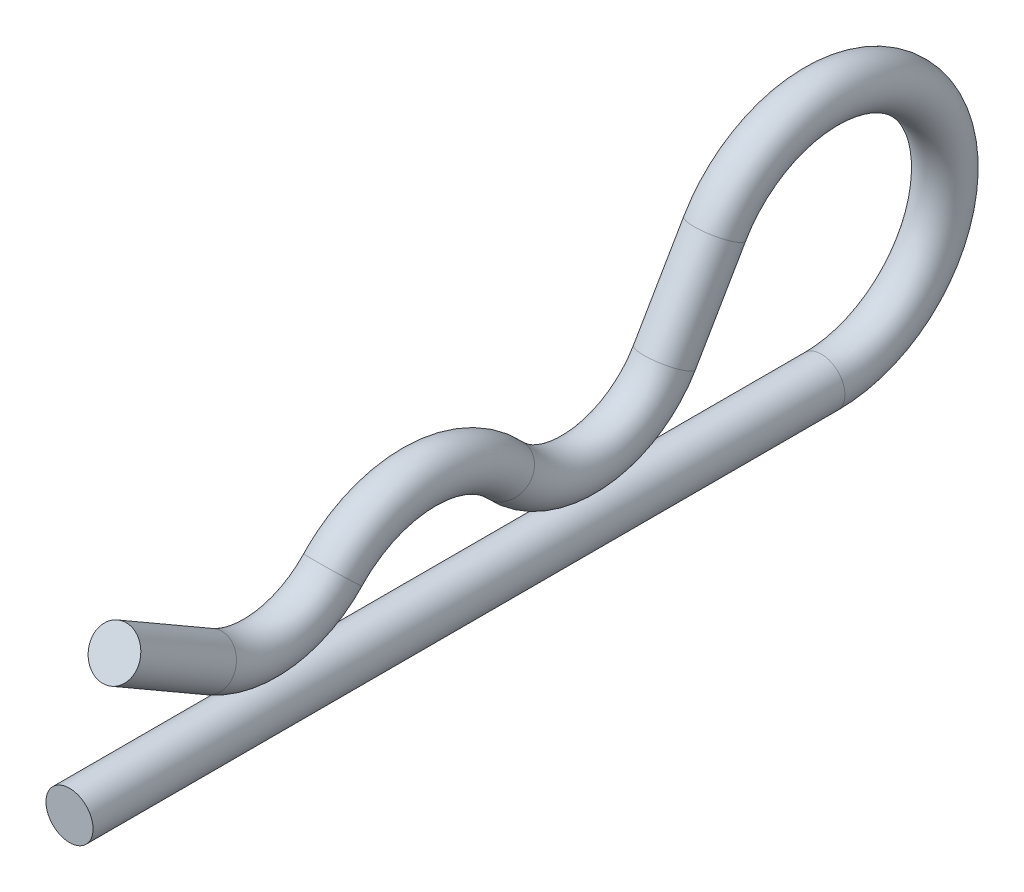
from build123d import *

# Parameters (mm, degrees)
SKETCH2_R = 0.7493


with BuildPart() as part:
    # Sweep1: sweep along a path in Sketch3
    with BuildLine(Plane(origin=(0, 0, 0), x_dir=(0, 0, -1), z_dir=(1, 0, 0))) as sweep1_path:
        Line((-10.52195, 3.754322439), (-7.481468009, 1.998899343))
        ThreePointArc((-7.481468009, 1.998899343), (-5.43029433, 1.607569682), (-3.579686289, 2.574886717))
        ThreePointArc((-3.579686289, 2.574886717), (-0.8382, 3.761088762), (1.903286289, 2.574886717))
        ThreePointArc((1.903286289, 2.574886717), (4.577697214, 1.594020219), (6.962215926, 3.152430752))
        Line((6.962215926, 3.152430752), (8.558315174, 5.89707867))
        ThreePointArc((8.558315174, 5.89707867), (15.352310341, 5.881128449), (11.9507, 0))
        Line((11.9507, 0), (-11.9507, 0))
    # Sketch2 → Sweep1 (sweep)
    with BuildSketch(Plane.XY.offset(11.9507)):
        Circle(SKETCH2_R)
    sweep(path=sweep1_path.line)


solid = part.part
